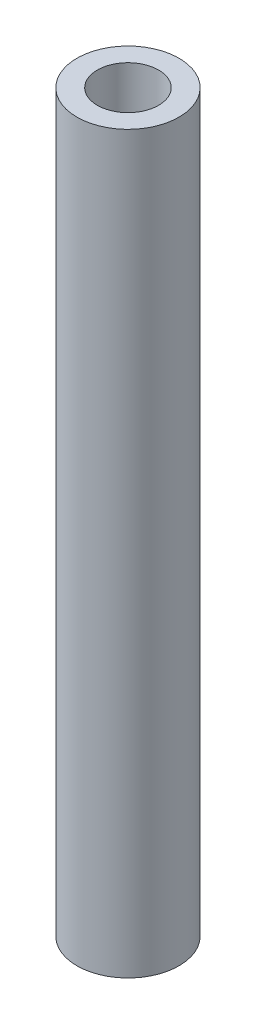
from build123d import *

# Parameters (mm, degrees)
SKETCH1_R           = 7.9375
SKETCH1_R_2         = 4.7625
BOSS_EXTRUDE1_DEPTH = 114.3


with BuildPart() as part:
    # Sketch1 → Boss-Extrude1 (new body)
    with BuildSketch(Plane(origin=(0, 0, 0), x_dir=(1, 0, 0), z_dir=(0, 1, 0))):
        with Locations(Location((0, 0, 0), (0, 0, 270))):
            Circle(SKETCH1_R)
        with Locations(Location((0, 0, 0), (0, 0, 270))):
            Circle(SKETCH1_R_2, mode=Mode.SUBTRACT)
    extrude(amount=BOSS_EXTRUDE1_DEPTH)


solid = part.part
